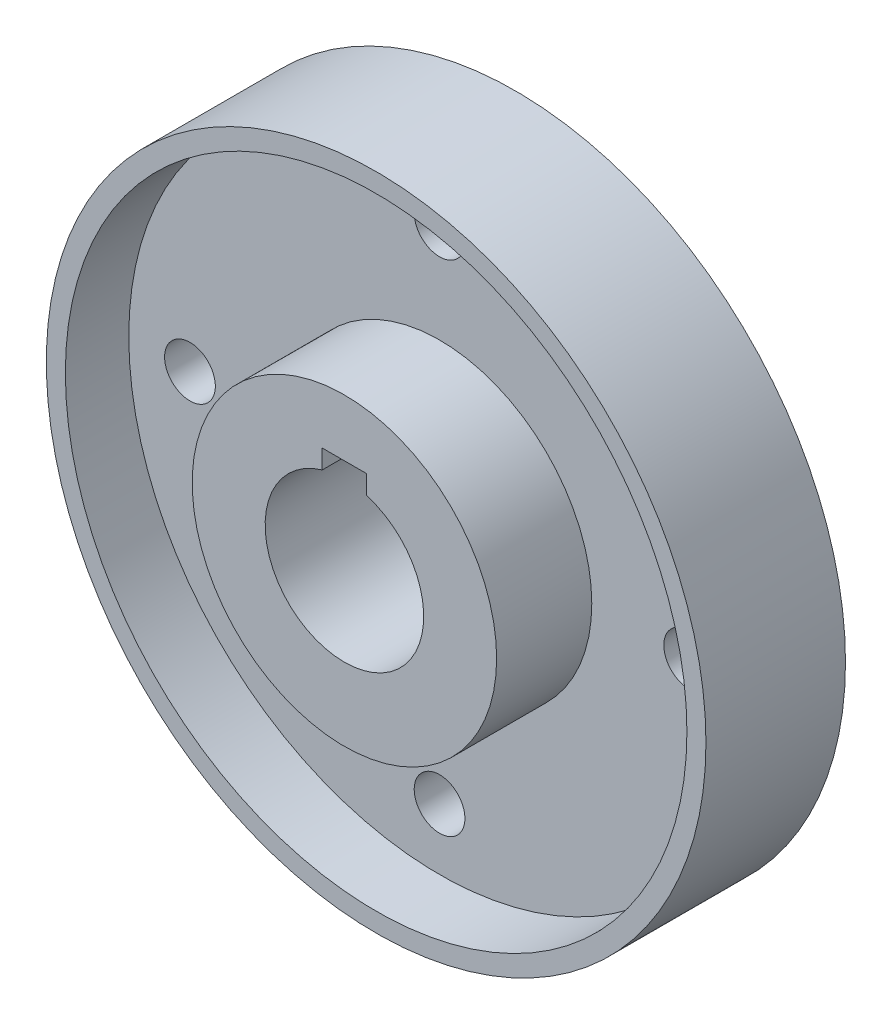
from build123d import *

# Parameters (mm, degrees)
SKETCH2_W          = 14
SKETCH2_H          = 10
CUT_EXTRUDE1_DEPTH = 73
SKETCH3_R          = 8
CUT_EXTRUDE2_DEPTH = 217
CIRPATTERN1_COUNT  = 4


with BuildPart() as part:
    # Sketch1 → Revolve1 (revolve)
    with BuildSketch(Plane(origin=(0, 0, 0), x_dir=(0, 0, -1), z_dir=(1, 0, 0)), mode=Mode.PRIVATE) as revolve1_sk:
        Polygon((-44, 104), (0, 104), (0, 48), (3, 48), (3, 25), (-54, 25), (-54, 48), (-24, 48), (-24, 98), (-44, 98), align=None)
    revolve(revolve1_sk.sketch.rotate(Axis((0, 0, 52.496471852), (0, 0, -1)), 90), axis=Axis((0, 0, 52.496471852), (0, 0, -1)))

    # Sketch2 → Cut-Extrude1 (cut, symmetric)
    with BuildSketch(Plane.XY):
        with Locations((0, 25)):
            Rectangle(SKETCH2_W, SKETCH2_H)
    extrude(amount=CUT_EXTRUDE1_DEPTH, both=True, mode=Mode.SUBTRACT)

    # Sketch3 → Cut-Extrude2 (cut)
    with BuildSketch(Plane.XY):
        with Locations(Location((0, 78.704447468, 0), (0, 0, 180))):
            Circle(SKETCH3_R)
    cut_extrude2 = extrude(amount=CUT_EXTRUDE2_DEPTH, mode=Mode.SUBTRACT)

    # CirPattern1: Cut-Extrude2 ×4 about axis
    cirpattern1_axis = Axis((0, 0, 0), (0, 0, 1))
    for i in range(1, CIRPATTERN1_COUNT):
        add(cut_extrude2.rotate(cirpattern1_axis, i * 360 / CIRPATTERN1_COUNT), mode=Mode.SUBTRACT)


solid = part.part
